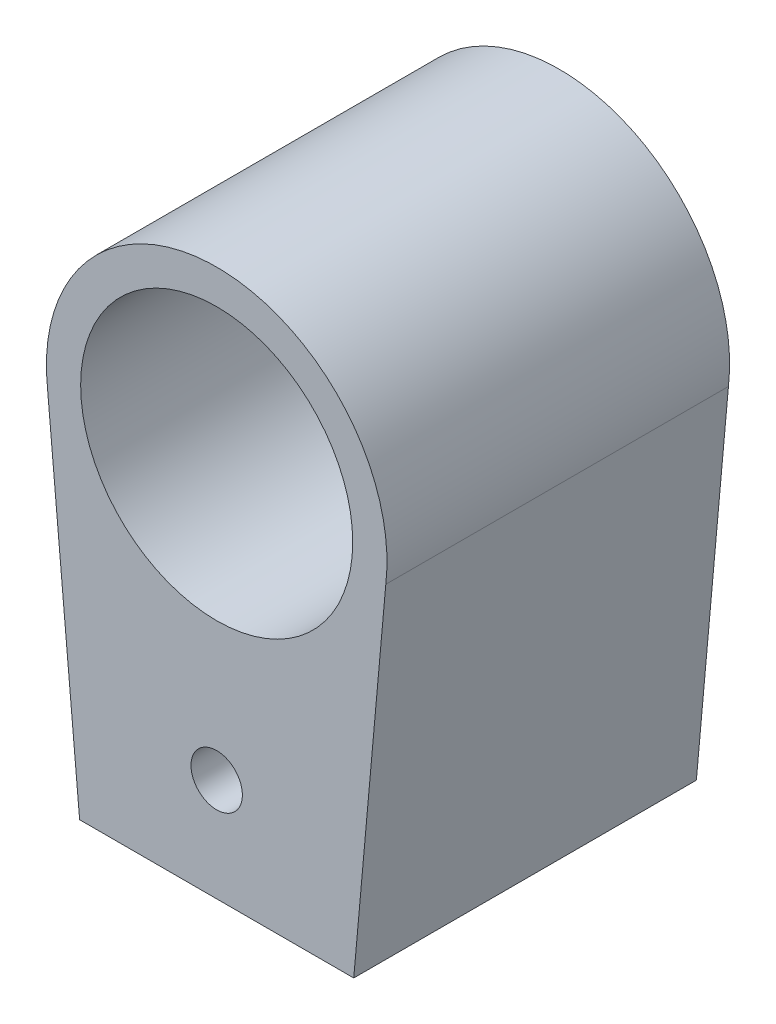
from build123d import *

# Parameters (mm, degrees)
SKETCH1_R           = 7.94
BOSS_EXTRUDE1_DEPTH = 10
BOSS_EXTRUDE2_START = 2.25
SKETCH1_3_W         = 10
SKETCH1_3_H         = 10
SKETCH1_3_R         = 1.5
BOSS_EXTRUDE2_DEPTH = 7.75


with BuildPart() as part:
    # Sketch1 → Boss-Extrude1 (new body)
    with BuildSketch(Plane.XY):
        with BuildLine():
            Line((-5, -12), (5, -12))
            Line((5, -12), (5, -22))
            Line((5, -22), (8, -22))
            Line((8, -22), (9.871863704, -1.161854982))
            ThreePointArc((9.871863704, -1.161854982), (0, 9.94), (-9.871863704, -1.161854982))
            Line((-9.871863704, -1.161854982), (-8, -22))
            Line((-8, -22), (-5, -22))
            Line((-5, -22), (-5, -12))
        make_face()
        Circle(SKETCH1_R, mode=Mode.SUBTRACT)
    extrude(amount=BOSS_EXTRUDE1_DEPTH)

    # Sketch1<3> → Boss-Extrude2 (add)
    with BuildSketch(Plane.XY.offset(BOSS_EXTRUDE2_START)):
        with Locations((0, -17)):
            Rectangle(SKETCH1_3_W, SKETCH1_3_H)
        with Locations((0, -16)):
            Circle(SKETCH1_3_R, mode=Mode.SUBTRACT)
    extrude(amount=BOSS_EXTRUDE2_DEPTH)

    # Mirror1: part across plane


with BuildPart() as part_1:
    add(part.part)
    add(part.part.mirror(Plane.XY))


solid = part_1.part
